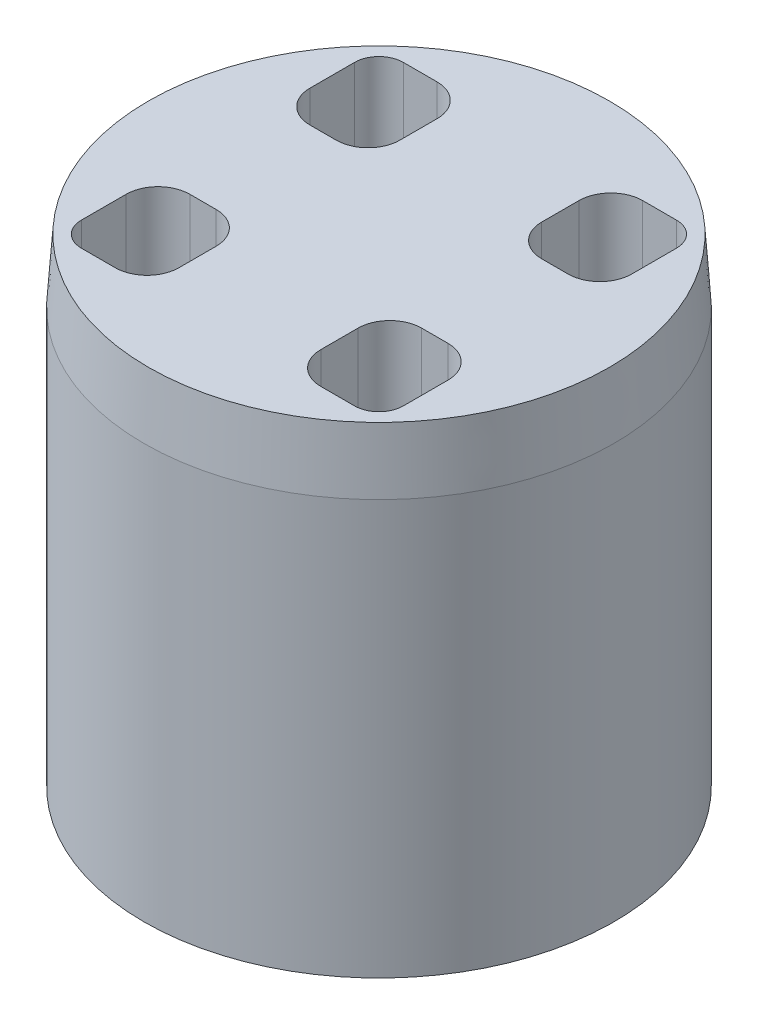
from build123d import *

# Parameters (mm, degrees)
SKETCH2_R           = 73.75
MAINDOUGHNUT_DEPTH  = 150
SKETCH3_R           = 3.81
CUT_EXTRUDE1_DEPTH  = 183.696811685
NOSECONETAPER_SIZE  = 20
NOSECONETAPER_SIZE2 = 1.398536239
PAYLOADSTOPS_DEPTH  = 90
FILLET1_R           = 10
FILLET2_R           = 10
FILLET3_R           = 10
CHAMFER1_SIZE       = 3


with BuildPart() as part:
    # Sketch2 → MainDoughnut (new body)
    with BuildSketch(Plane(origin=(0, 0, 0), x_dir=(1, 0, 0), z_dir=(0, 1, 0))):
        with Locations(Location((0, 0, 0), (0, 0, 270))):
            Circle(SKETCH2_R)
        with BuildLine():
            Line((42.87, -50.5), (-42.87, -50.5))
            ThreePointArc((-42.87, -50.5), (-48.26522474, -48.26522474), (-50.5, -42.87))
            Line((-50.5, -42.87), (-50.5, 42.87))
            ThreePointArc((-50.5, 42.87), (-48.26522474, 48.26522474), (-42.87, 50.5))
            Line((-42.87, 50.5), (42.87, 50.5))
            ThreePointArc((42.87, 50.5), (48.26522474, 48.26522474), (50.5, 42.87))
            Line((50.5, 42.87), (50.5, -42.87))
            ThreePointArc((50.5, -42.87), (48.26522474, -48.26522474), (42.87, -50.5))
        make_face(mode=Mode.SUBTRACT)
    extrude(amount=MAINDOUGHNUT_DEPTH)

    # Sketch3 → Cut-Extrude1 (cut, through all)
    with BuildSketch(Plane(origin=(0, 150, 0), x_dir=(1, 0, 0), z_dir=(0, 1, 0))):
        with Locations(Location((-62.711477498, 0, 0), (0, 0, 270))):
            Circle(SKETCH3_R)
        with Locations(Location((0, 62.711477498, 0), (0, 0, 270))):
            Circle(SKETCH3_R)
        with Locations(Location((62.711477498, 0, 0), (0, 0, 270))):
            Circle(SKETCH3_R)
        with Locations(Location((0, -62.711477498, 0), (0, 0, 270))):
            Circle(SKETCH3_R)
    extrude(amount=-CUT_EXTRUDE1_DEPTH, mode=Mode.SUBTRACT)

    # NoseconeTaper
    noseconetaper_edges = [part.edges().sort_by_distance(p)[0] for p in [
        (0, 150, -73.75),
    ]]
    noseconetaper_side = [part.faces().sort_by_distance(p)[0] for p in [
        (0, 75, -73.75),
    ]]
    chamfer(noseconetaper_edges, length=NOSECONETAPER_SIZE, length2=NOSECONETAPER_SIZE2, reference=noseconetaper_side[0])

    # Sketch5 → PayloadStops (add)
    with BuildSketch(Plane(origin=(0, 150, 0), x_dir=(1, 0, 0), z_dir=(0, 1, 0))):
        with BuildLine():
            Line((-22.25166399, 28.829478379), (-22.25166399, 68.844736604))
            Line((-22.25166399, 68.844736604), (22.25166399, 68.844736604))
            Line((22.25166399, 68.844736604), (22.25166399, 28.829478379))
            ThreePointArc((22.25166399, 28.829478379), (25.180596178, 21.758410568), (32.25166399, 18.829478379))
            Line((32.25166399, 18.829478379), (68.578942308, 18.829478379))
            Line((68.578942308, 18.829478379), (68.578942308, -18.829478379))
            Line((68.578942308, -18.829478379), (32.25166399, -18.829478379))
            ThreePointArc((32.25166399, -18.829478379), (25.180596178, -21.758410568), (22.25166399, -28.829478379))
            Line((22.25166399, -28.829478379), (22.25166399, -67.546162244))
            Line((22.25166399, -67.546162244), (-22.25166399, -67.546162244))
            Line((-22.25166399, -67.546162244), (-22.25166399, -28.829478379))
            ThreePointArc((-22.25166399, -28.829478379), (-25.180596178, -21.758410568), (-32.25166399, -18.829478379))
            Line((-32.25166399, -18.829478379), (-69.858321282, -18.829478379))
            Line((-69.858321282, -18.829478379), (-69.858321282, 18.829478379))
            Line((-69.858321282, 18.829478379), (-32.25166399, 18.829478379))
            ThreePointArc((-32.25166399, 18.829478379), (-25.180596178, 21.758410568), (-22.25166399, 28.829478379))
        make_face()
    extrude(amount=-PAYLOADSTOPS_DEPTH)

    # Fillet1
    fillet1_edges = [part.edges().sort_by_distance(p)[0] for p in [
        (-22.25166399, 105, -50.5),
    ]]
    fillet(fillet1_edges, radius=FILLET1_R)

    # Fillet2
    fillet2_edges = [part.edges().sort_by_distance(p)[0] for p in [
        (-50.5, 105, -18.829478379),
    ]]
    fillet(fillet2_edges, radius=FILLET2_R)

    # Fillet3
    fillet3_edges = [part.edges().sort_by_distance(p)[0] for p in [
        (50.5, 105, 18.829478379),
        (50.5, 105, -18.829478379),
        (-22.25166399, 105, 50.5),
        (22.25166399, 105, 50.5),
        (22.25166399, 105, -50.5),
        (-50.5, 105, 18.829478379),
    ]]
    fillet(fillet3_edges, radius=FILLET3_R)

    # Chamfer1
    chamfer1_edges = [part.edges().sort_by_distance(p)[0] for p in [
        (-48.26522474, 0, -48.26522474),
        (-50.5, 0, 0),
        (-48.26522474, 0, 48.26522474),
        (0, 0, 50.5),
        (48.26522474, 0, 48.26522474),
        (50.5, 0, 0),
        (48.26522474, 0, -48.26522474),
        (0, 0, -50.5),
    ]]
    chamfer(chamfer1_edges, length=CHAMFER1_SIZE)


solid = part.part
